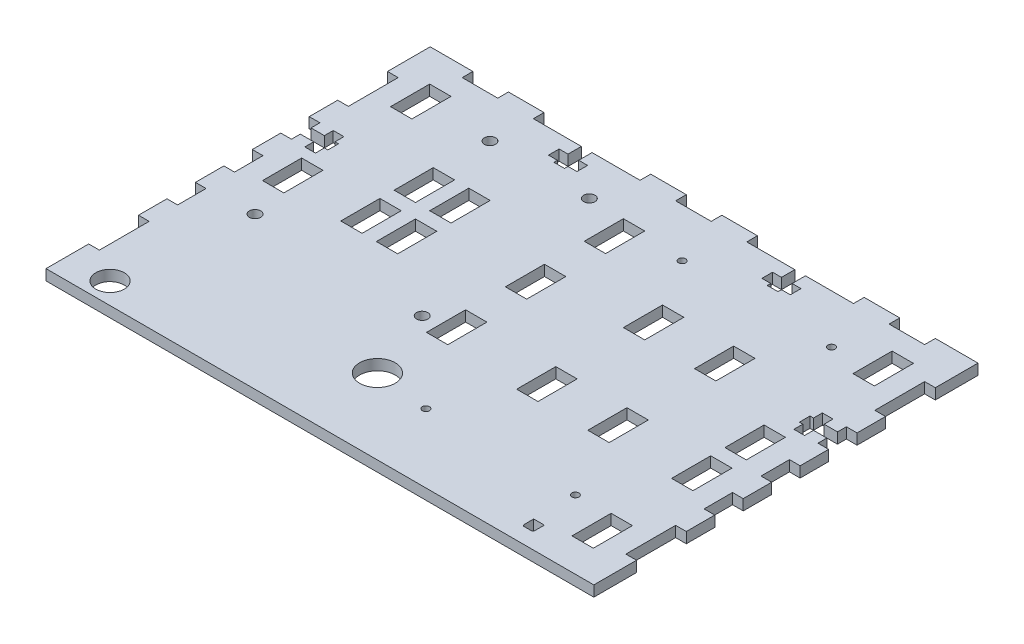
from build123d import *

# Parameters (mm, degrees)
CROQUIS1_R              = 4
SALIENTE_EXTRUIR1_DEPTH = 1.5
CROQUIS2_R              = 5
CROQUIS2_R_2            = 1
CROQUIS2_W              = 6
CROQUIS2_H              = 11
CORTAR_EXTRUIR1_DEPTH   = 3
CROQUIS3_R              = 1.5875
CROQUIS3_R_2            = 1.590536349
CORTAR_EXTRUIR2_DEPTH   = 23


with BuildPart() as part:
    # Croquis1 → Saliente-Extruir1 (new, symmetric)
    with BuildSketch(Plane(origin=(0, 0, 0), x_dir=(1, 0, 0), z_dir=(0, 1, 0))):
        Polygon((-77, -42), (-77, -54), (77, -54), (77, -42), (74, -42), (74, -28), (77, -28), (77, -20), (74, -20), (74, -12), (77, -12), (77, -4), (74, -4), (74, -1.5), (74, 1.5), (74, 4), (77, 4), (77, 12), (74, 12), (74, 14.5), (70.25, 14.5), (70.25, 12), (67.25, 12), (67.25, 14.5), (66.27, 14.5), (66.27, 17.5), (67.25, 17.5), (67.25, 20), (70.25, 20), (70.25, 17.5), (74, 17.5), (74, 20), (77, 20), (77, 28), (74, 28), (74, 42), (77, 42), (77, 54), (65, 54), (65, 51), (55, 51), (55, 54), (45, 54), (45, 51), (31.5, 51), (31.5, 47.25), (34, 47.25), (34, 44.25), (31.5, 44.25), (31.5, 43.27), (28.5, 43.27), (28.5, 44.25), (26, 44.25), (26, 47.25), (28.5, 47.25), (28.5, 51), (15, 51), (15, 54), (5, 54), (5, 51), (-5, 51), (-5, 54), (-15, 54), (-15, 51), (-28.5, 51), (-28.5, 47.25), (-26, 47.25), (-26, 44.25), (-28.5, 44.25), (-28.5, 43.27), (-31.5, 43.27), (-31.5, 44.25), (-34, 44.25), (-34, 47.25), (-31.5, 47.25), (-31.5, 51), (-45, 51), (-45, 54), (-55, 54), (-55, 51), (-65, 51), (-65, 54), (-77, 54), (-77, 42), (-74, 42), (-74, 28), (-77, 28), (-77, 20), (-74, 20), (-74, 17.5), (-70.25, 17.5), (-70.25, 20), (-67.25, 20), (-67.25, 17.5), (-66.27, 17.5), (-66.27, 14.5), (-67.25, 14.5), (-67.25, 12), (-70.25, 12), (-70.25, 14.5), (-74, 14.5), (-74, 12), (-77, 12), (-77, 4), (-74, 4), (-74, 1.5), (-74, -1.5), (-74, -4), (-77, -4), (-77, -12), (-74, -12), (-74, -20), (-77, -20), (-77, -28), (-74, -28), (-74, -42), align=None)
        with Locations(Location((-65, -48, 0), (0, 0, 270))):
            Circle(CROQUIS1_R, mode=Mode.SUBTRACT)
        with BuildLine():
            Line((55, -49.6), (53, -49.6))
            ThreePointArc((53, -49.6), (52.646446609, -49.453553391), (52.5, -49.1))
            Line((52.5, -49.1), (52.5, -46.4))
            Line((52.5, -46.4), (55.5, -46.4))
            Line((55.5, -46.4), (55.5, -49.1))
            ThreePointArc((55.5, -49.1), (55.353553391, -49.453553391), (55, -49.6))
        make_face(mode=Mode.SUBTRACT)
    extrude(amount=SALIENTE_EXTRUIR1_DEPTH, both=True)

    # Croquis2 → Cortar-Extruir1 (cut)
    with BuildSketch(Plane(origin=(0, 1.5, 0), x_dir=(1, 0, 0), z_dir=(0, 1, 0))):
        with Locations(Location((-5, -32.83, 0), (0, 0, 270))):
            Circle(CROQUIS2_R)
        with Locations(Location((10.51, 37.3, 0), (0, 0, 270))):
            Circle(CROQUIS2_R_2)
        with Locations(Location((52.51, 37.3, 0), (0, 0, 270))):
            Circle(CROQUIS2_R_2)
        with Locations(Location((52.51, -34.7, 0), (0, 0, 270))):
            Circle(CROQUIS2_R_2)
        with Locations(Location((10.51, -34.7, 0), (0, 0, 270))):
            Circle(CROQUIS2_R_2)
        with Locations((-34.16, 4.52)):
            Rectangle(CROQUIS2_W, CROQUIS2_H)
        with Locations((-5, 33.81)):
            Rectangle(CROQUIS2_W, CROQUIS2_H)
        with Locations((-44.16, 4.52)):
            Rectangle(CROQUIS2_W, CROQUIS2_H)
        with Locations((-44.16, 19.52)):
            Rectangle(CROQUIS2_W, CROQUIS2_H)
        with Locations((-34.16, 19.52)):
            Rectangle(CROQUIS2_W, CROQUIS2_H)
        with Locations((-5, 11.63)):
            Rectangle(CROQUIS2_W, CROQUIS2_H)
        with Locations((-5, -10.55)):
            Rectangle(CROQUIS2_W, CROQUIS2_H)
        with Locations((21.51, 18.3)):
            Rectangle(CROQUIS2_W, CROQUIS2_H)
        with Locations((41.51, 18.3)):
            Rectangle(CROQUIS2_W, CROQUIS2_H)
        with Locations((41.51, -11.7)):
            Rectangle(CROQUIS2_W, CROQUIS2_H)
        with Locations((21.51, -11.7)):
            Rectangle(CROQUIS2_W, CROQUIS2_H)
        with Locations((65, 39.36)):
            Rectangle(CROQUIS2_W, CROQUIS2_H)
        with Locations((65, -11.64)):
            Rectangle(CROQUIS2_W, CROQUIS2_H)
        with Locations((65, -39.64)):
            Rectangle(CROQUIS2_W, CROQUIS2_H)
        with Locations((65, 3.36)):
            Rectangle(CROQUIS2_W, CROQUIS2_H)
        with Locations((-65, 3.36)):
            Rectangle(CROQUIS2_W, CROQUIS2_H)
        with Locations((-65, 39.36)):
            Rectangle(CROQUIS2_W, CROQUIS2_H)
    extrude(amount=-CORTAR_EXTRUIR1_DEPTH, mode=Mode.SUBTRACT)

    # Croquis3 → Cortar-Extruir2 (cut)
    with BuildSketch(Plane(origin=(0, 1.5, 0), x_dir=(1, 0, 0), z_dir=(0, 1, 0))):
        with Locations(Location((-60.888852319, -11.348115731, 0), (0, 0, 270))):
            Circle(CROQUIS3_R)
        with Locations(Location((-12.628852319, -12.618115731, 0), (0, 0, 270))):
            Circle(CROQUIS3_R)
        with Locations(Location((-45.648852319, 39.451884269, 0), (0, 0, 270))):
            Circle(CROQUIS3_R)
        with Locations(Location((-17.708852319, 39.451884269, 0), (0, 0, 270))):
            Circle(CROQUIS3_R_2)
    extrude(amount=-CORTAR_EXTRUIR2_DEPTH, mode=Mode.SUBTRACT)


solid = part.part
